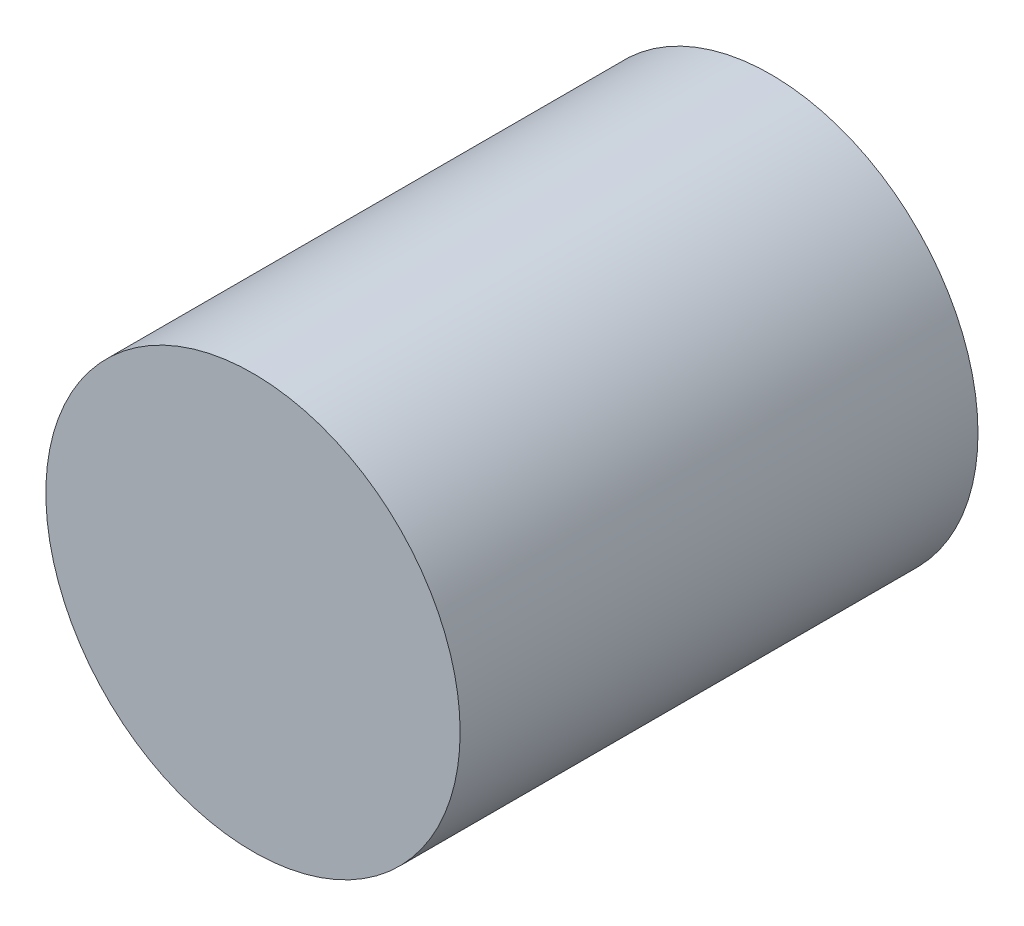
from build123d import *

# Parameters (mm, degrees)
SKETCH_1_R      = 20
EXTRUDE_1_DEPTH = 50


with BuildPart() as part:
    # Эскиз1 → Бобышка-Вытянуть1 (new body)
    with BuildSketch(Plane.XY):
        Circle(SKETCH_1_R)
    extrude(amount=EXTRUDE_1_DEPTH)


solid = part.part
